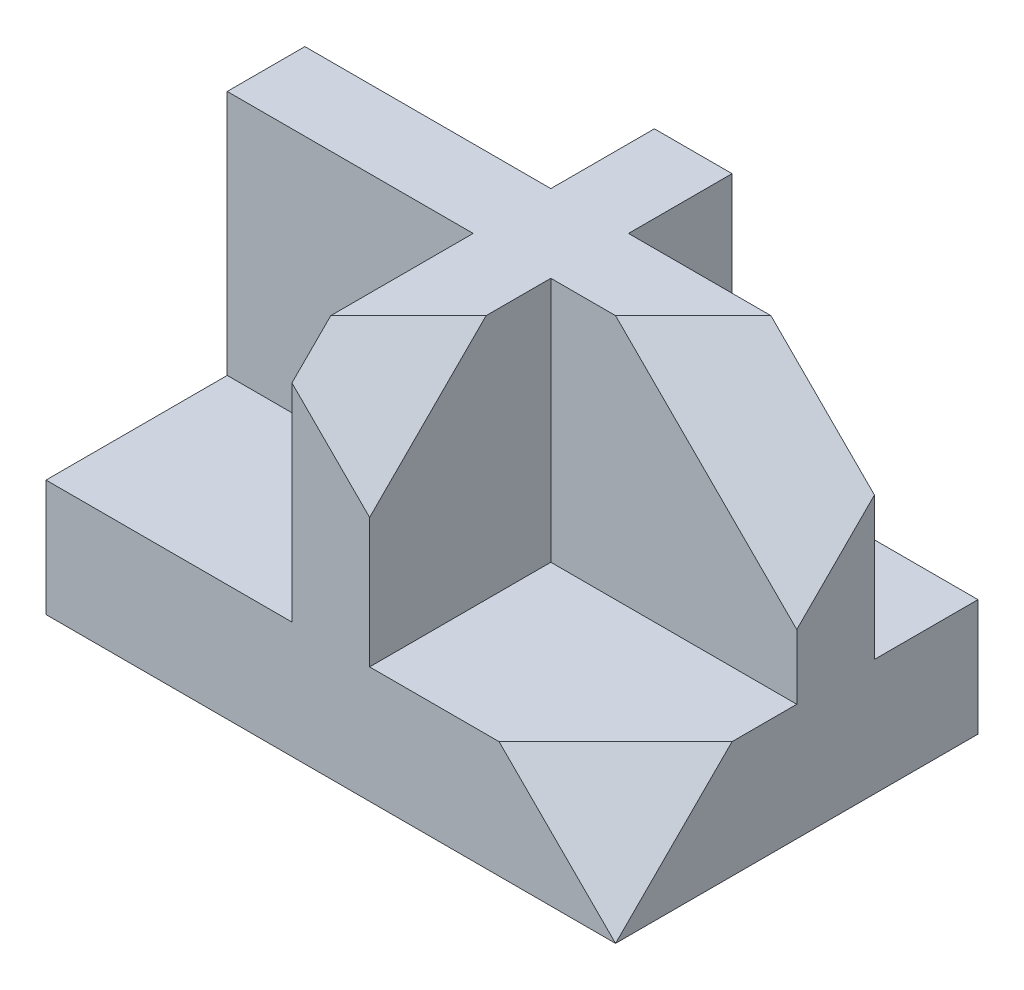
from build123d import *

# Parameters (mm, degrees)
SKETCH1_W           = 88
SKETCH1_H           = 56
BOSS_EXTRUDE1_DEPTH = 18
BOSS_EXTRUDE2_DEPTH = 56
SKETCH4_W           = 161.292605704
SKETCH4_H           = 128.574655565
CUT_EXTRUDE1_DEPTH  = 56


with BuildPart() as part:
    # Sketch1 → Boss-Extrude1 (new body)
    with BuildSketch(Plane(origin=(0, 0, 0), x_dir=(1, 0, 0), z_dir=(0, 1, 0))):
        with Locations((1.76, 28)):
            Rectangle(SKETCH1_W, SKETCH1_H)
    extrude(amount=BOSS_EXTRUDE1_DEPTH)

    # Sketch1<3> → Boss-Extrude2 (add)
    with BuildSketch(Plane(origin=(0, 0, 0), x_dir=(1, 0, 0), z_dir=(0, 1, 0))):
        Polygon((-42.24, 40), (-42.24, 28), (-4.24, 28), (-4.24, 0), (7.76, 0), (7.76, 28), (45.76, 28), (45.76, 40), (7.76, 40), (7.76, 56), (-4.24, 56), (-4.24, 40), align=None)
    extrude(amount=BOSS_EXTRUDE2_DEPTH)

    # Sketch4 → Cut-Extrude1 (cut)
    with BuildSketch(Plane(origin=(15.253333333, 15.253333333, 15.253333333), x_dir=(0.40824829046386324, 0.40824829046386196, -0.8164965809277265), z_dir=(0.5773502691896268, 0.5773502691896253, 0.5773502691896252))):
        with Locations((33.378380228, 7.240773439)):
            Rectangle(SKETCH4_W, SKETCH4_H)
    extrude(amount=CUT_EXTRUDE1_DEPTH, mode=Mode.SUBTRACT)


solid = part.part
